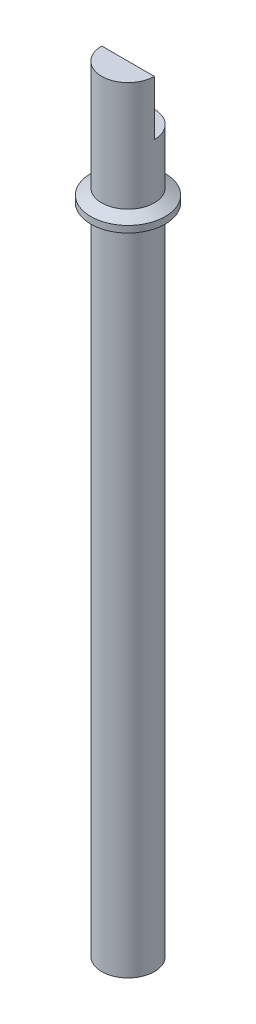
from build123d import *

# Parameters (mm, degrees)
CUT_EXTRUDE1_START = -1.25
CUT_EXTRUDE1_DEPTH = 1.25


with BuildPart() as part:
    # Sketch1 → Revolve1 (revolve)
    with BuildSketch(Plane.XY, mode=Mode.PRIVATE) as revolve1_sk:
        Polygon((0, 0), (0, -2.5), (-0.25, -2.644337567), (-0.25, -2.794337567), (0, -2.938675135), (0, -17.688675135), (0.6, -17.688675135), (0.6, 0), align=None)
    revolve(revolve1_sk.sketch.rotate(Axis((0.6, -17.688675135, 0), (0, 1, 0)), 270), axis=Axis((0.6, -17.688675135, 0), (0, 1, 0)))

    # Sketch2 → Cut-Extrude1 (cut)
    with BuildSketch(Plane(origin=(0, 0, 0), x_dir=(1, 0, 0), z_dir=(0, 1, 0)).offset(CUT_EXTRUDE1_START)):
        with BuildLine():
            Line((0, 0), (1.2, 0))
            ThreePointArc((1.2, 0), (0.6, 0.6), (0, 0))
        make_face()
    extrude(amount=CUT_EXTRUDE1_DEPTH, mode=Mode.SUBTRACT)


solid = part.part
